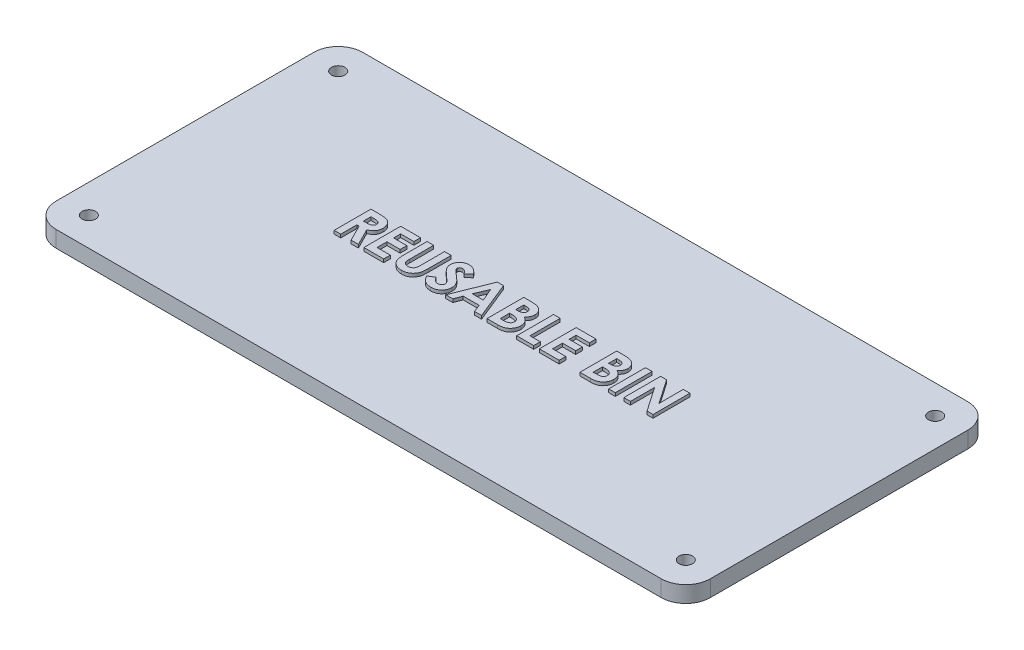
from build123d import *

# Parameters (mm, degrees)
LID_DEPTH          = 4
SKETCH2_R          = 1.65
SCREW_HOLES_DEPTH  = 110.731490467
SKETCH3_W          = 1.615384615
SKETCH3_H          = 9
TITLE_RAISED_DEPTH = 0.8


with BuildPart() as part:
    # Sketch1 → Lid (new body)
    with BuildSketch(Plane(origin=(0, 150, 0), x_dir=(1, 0, 0), z_dir=(0, 1, 0))):
        with BuildLine():
            Line((-74, -75), (74, -75))
            ThreePointArc((74, -75), (78.242640687, -73.242640687), (80, -69))
            Line((80, -69), (80, -6))
            ThreePointArc((80, -6), (78.242640687, -1.757359313), (74, 0))
            Line((74, 0), (-74, 0))
            ThreePointArc((-74, 0), (-78.242640687, -1.757359313), (-80, -6))
            Line((-80, -6), (-80, -69))
            ThreePointArc((-80, -69), (-78.242640687, -73.242640687), (-74, -75))
        make_face()
    extrude(amount=LID_DEPTH)

    # Sketch2 → Screw holes (cut, through all)
    with BuildSketch(Plane(origin=(0, 150, 0), x_dir=(1, 0, 0), z_dir=(0, 1, 0))):
        with Locations(Location((-73, -7, 0), (0, 0, 270))):
            Circle(SKETCH2_R)
        with Locations(Location((73, -7, 0), (0, 0, 270))):
            Circle(SKETCH2_R)
        with Locations(Location((-73, -68, 0), (0, 0, 270))):
            Circle(SKETCH2_R)
        with Locations(Location((73, -68, 0), (0, 0, 270))):
            Circle(SKETCH2_R)
    extrude(amount=SCREW_HOLES_DEPTH, mode=Mode.SUBTRACT)

    # Sketch3 → Title (raised) (add)
    # profile 1 of 11: a face of its own
    with BuildSketch(Plane(origin=(0, 154, 0), x_dir=(1, 0, 0), z_dir=(0, 1, 0))):
        with BuildLine():
            Line((-39, -33), (-37.117788462, -33))
            add(Edge.make_bspline(
                [(-37.117788462, -33), (-36.993374852, -33.000441597), (-36.754092435, -33.001290912), (-36.409060259, -33.014690857), (-36.092100756, -33.03333798), (-35.802744638, -33.061793985), (-35.541115697, -33.099523208), (-35.306951719, -33.143999719), (-35.100259549, -33.194690238), (-34.919296024, -33.257854624), (-34.755985391, -33.329103094), (-34.603757177, -33.410968893), (-34.459253, -33.502540419), (-34.323438716, -33.606227166), (-34.195134065, -33.720163836), (-34.074096994, -33.844465117), (-33.962037869, -33.980185032), (-33.859650564, -34.126466005), (-33.766332777, -34.280350234), (-33.683859426, -34.442049003), (-33.616791959, -34.611674763), (-33.557530663, -34.786776055), (-33.514846671, -34.969855986), (-33.485160579, -35.159132243), (-33.463425584, -35.355271097), (-33.462175926, -35.488519126), (-33.461538462, -35.556490385)],
                knots=[0, 0, 0, 0, 1.749336639, 3.364467119, 4.854658419, 6.213483162, 7.451590619, 8.570285859, 9.5643256, 10.440900261, 11.26203566, 12.067320669, 12.869050712, 13.665104639, 14.467235401, 15.27997916, 16.102287765, 16.939272006, 17.78853747, 18.631303466, 19.488103222, 20.351255419, 21.228522269, 22.127379805, 23.044756219, 24, 24, 24, 24], degree=3))
            add(Edge.make_bspline(
                [(-33.461538462, -35.556490385), (-33.463194364, -35.627436764), (-33.466441288, -35.766549683), (-33.483930984, -35.970895215), (-33.515896655, -36.166398727), (-33.564313313, -36.352487808), (-33.619961974, -36.531478554), (-33.693960417, -36.700068474), (-33.777474974, -36.860709464), (-33.876662774, -37.011129196), (-33.985516538, -37.154668794), (-34.112111177, -37.285828721), (-34.248245301, -37.411658329), (-34.401571505, -37.524276077), (-34.565331029, -37.631296771), (-34.742777602, -37.72828602), (-34.932753146, -37.817681911), (-35.066315361, -37.867535235), (-35.134615385, -37.893028846)],
                knots=[0, 0, 0, 0, 1.099860209, 2.156625411, 3.176576793, 4.16617041, 5.135385252, 6.078461593, 7.016046972, 7.938469504, 8.868247731, 9.803980173, 10.76021508, 11.73834243, 12.748633912, 13.790971185, 14.870363756, 16, 16, 16, 16], degree=3))
            Line((-35.134615385, -37.893028846), (-33.057692308, -42))
            Line((-33.057692308, -42), (-34.853365385, -42))
            Line((-34.853365385, -42), (-36.836538462, -38.076923077))
            Line((-36.836538462, -38.076923077), (-37.384615385, -38.076923077))
            Line((-37.384615385, -38.076923077), (-37.384615385, -42))
            Line((-37.384615385, -42), (-39, -42))
            Line((-39, -42), (-39, -33))
        make_face()
        with BuildLine():
            Line((-37.384615385, -36.461538462), (-36.755408654, -36.461538462))
            add(Edge.make_bspline(
                [(-36.755408654, -36.461538462), (-36.678482901, -36.460672072), (-36.531186613, -36.459013122), (-36.319355205, -36.451318225), (-36.126961767, -36.432777326), (-35.953180097, -36.409351594), (-35.797135742, -36.382303202), (-35.660220562, -36.343541215), (-35.540324904, -36.302006764), (-35.438869534, -36.250390216), (-35.352188397, -36.191691006), (-35.277344784, -36.125007243), (-35.215438385, -36.04782928), (-35.16448626, -35.962254479), (-35.124851047, -35.867525952), (-35.095920377, -35.764683605), (-35.079752412, -35.65255593), (-35.077892232, -35.575172566), (-35.076923077, -35.534855769)],
                knots=[0, 0, 0, 0, 1.688639943, 3.233382647, 4.650958383, 5.928841754, 7.082724185, 8.122798841, 9.049171256, 9.863274652, 10.613301712, 11.341792392, 12.054588806, 12.776240173, 13.521029143, 14.301969904, 15.115324896, 16, 16, 16, 16], degree=3))
            add(Edge.make_bspline(
                [(-35.076923077, -35.534855769), (-35.078755353, -35.487158055), (-35.082354521, -35.393464734), (-35.118069446, -35.258579205), (-35.174919892, -35.133733419), (-35.252846282, -35.01949146), (-35.350984439, -34.919339073), (-35.463605718, -34.831053946), (-35.593140756, -34.761244674), (-35.713080454, -34.715199221), (-35.822197544, -34.687649751), (-35.920672275, -34.66712013), (-36.034706607, -34.652570199), (-36.164386629, -34.637137406), (-36.309381782, -34.627130022), (-36.470482377, -34.619826625), (-36.647225734, -34.616838447), (-36.77043264, -34.615883179), (-36.834735577, -34.615384615)],
                knots=[0, 0, 0, 0, 1.020303359, 2.004196876, 2.966617323, 3.9489082, 4.950758222, 5.960522915, 7.003732012, 8.091992268, 8.70421221, 9.413913587, 10.24622431, 11.166358409, 12.212345909, 13.359657661, 14.621978493, 16, 16, 16, 16], degree=3))
            Line((-36.834735577, -34.615384615), (-37.384615385, -34.615384615))
            Line((-37.384615385, -34.615384615), (-37.384615385, -36.461538462))
        make_face(mode=Mode.SUBTRACT)
    # profile 2 of 11: a face of its own
    with BuildSketch(Plane(origin=(0, 154, 0), x_dir=(1, 0, 0), z_dir=(0, 1, 0))):
        Polygon((-31.730769231, -33), (-26.884615385, -33), (-26.884615385, -34.615384615), (-30.115384615, -34.615384615), (-30.115384615, -36.346153846), (-26.884615385, -36.346153846), (-26.884615385, -37.961538462), (-30.115384615, -37.961538462), (-30.115384615, -40.384615385), (-26.884615385, -40.384615385), (-26.884615385, -42), (-31.730769231, -42), align=None)
    # profile 3 of 11: a face of its own
    with BuildSketch(Plane(origin=(0, 154, 0), x_dir=(1, 0, 0), z_dir=(0, 1, 0))):
        with BuildLine():
            Line((-25.269230769, -33), (-23.653846154, -33))
            Line((-23.653846154, -33), (-23.653846154, -38.855769231))
            add(Edge.make_bspline(
                [(-23.653846154, -38.855769231), (-23.653758317, -38.916479306), (-23.653588662, -39.03374019), (-23.645095615, -39.201971166), (-23.637323892, -39.356610658), (-23.623301497, -39.497489366), (-23.602585613, -39.624667556), (-23.582525878, -39.738962173), (-23.555377011, -39.838326902), (-23.514576603, -39.951429978), (-23.451716569, -40.078507462), (-23.34900676, -40.210950531), (-23.230488428, -40.331824054), (-23.08843738, -40.432434596), (-22.928784565, -40.513819455), (-22.752407204, -40.57411663), (-22.559553926, -40.607633852), (-22.426206464, -40.61275087), (-22.357572115, -40.615384615)],
                knots=[0, 0, 0, 0, 1.155499968, 2.231836252, 3.205919964, 4.102923608, 4.924856345, 5.658536265, 6.31071849, 6.882491295, 7.94666036, 8.992281882, 10.060072772, 11.158554251, 12.289267114, 13.461410017, 14.693379945, 16, 16, 16, 16], degree=3))
            add(Edge.make_bspline(
                [(-22.357572115, -40.615384615), (-22.28465659, -40.613256888), (-22.142483661, -40.609108179), (-21.937990536, -40.56838411), (-21.748526495, -40.503537445), (-21.57810314, -40.410984727), (-21.426890068, -40.300044075), (-21.298891371, -40.173536966), (-21.19787527, -40.031211082), (-21.132036733, -39.899904616), (-21.095071637, -39.779048448), (-21.067364457, -39.671068048), (-21.047052028, -39.543661865), (-21.028623925, -39.39881962), (-21.017550055, -39.235041028), (-21.005542248, -39.053643216), (-21.001141275, -38.853385013), (-21.000391161, -38.713941467), (-21, -38.641225962)],
                knots=[0, 0, 0, 0, 1.261321664, 2.459363699, 3.594844139, 4.716940403, 5.803436589, 6.833651888, 7.818396249, 8.814403945, 9.360733334, 10.004355033, 10.743453831, 11.592799886, 12.532235708, 13.585170094, 14.740740724, 16, 16, 16, 16], degree=3))
            Line((-21, -38.641225962), (-21, -33))
            Line((-21, -33), (-19.384615385, -33))
            Line((-19.384615385, -33), (-19.384615385, -38.368990385))
            add(Edge.make_bspline(
                [(-19.384615385, -38.368990385), (-19.38483971, -38.477765873), (-19.385271066, -38.686930529), (-19.391895395, -38.987514859), (-19.405997394, -39.262050429), (-19.417841446, -39.510617457), (-19.440763742, -39.732881082), (-19.464643398, -39.929790434), (-19.495080074, -40.100647709), (-19.540368017, -40.295147954), (-19.6185216, -40.519107863), (-19.744515421, -40.776987989), (-19.904456423, -41.029468254), (-20.093498693, -41.273771199), (-20.306944709, -41.500720762), (-20.540061915, -41.699953102), (-20.789146658, -41.868482178), (-21.056801695, -42.002187251), (-21.342799239, -42.106467128), (-21.64996902, -42.176537953), (-21.978101575, -42.223878682), (-22.204748932, -42.228426341), (-22.321514423, -42.230769231)],
                knots=[0, 0, 0, 0, 1.170808336, 2.251350247, 3.235597562, 4.129743112, 4.929140599, 5.639994148, 6.264258765, 6.79612947, 7.788252245, 8.809469599, 9.879094798, 10.999557536, 12.129761673, 13.226370002, 14.293821979, 15.358369427, 16.438775801, 17.562147481, 18.744053101, 20, 20, 20, 20], degree=3))
            add(Edge.make_bspline(
                [(-22.321514423, -42.230769231), (-22.399095738, -42.229462476), (-22.552162081, -42.226884276), (-22.777272991, -42.204151283), (-22.994886906, -42.170651399), (-23.20459493, -42.121778519), (-23.407124922, -42.058643885), (-23.602423074, -41.980929549), (-23.78976361, -41.889068989), (-23.968098199, -41.783907126), (-24.137207386, -41.670192673), (-24.291764454, -41.544135416), (-24.437088074, -41.415057764), (-24.568979907, -41.277527581), (-24.688430578, -41.132988701), (-24.79519408, -40.98111355), (-24.889111796, -40.821915619), (-24.972546175, -40.652525375), (-25.043957861, -40.464333323), (-25.104160595, -40.250645393), (-25.156755119, -40.008112242), (-25.195840267, -39.736187454), (-25.231275091, -39.435767264), (-25.253703381, -39.106069031), (-25.265436629, -38.747083296), (-25.267934099, -38.498205928), (-25.269230769, -38.368990385)],
                knots=[0, 0, 0, 0, 1.001158378, 1.975264943, 2.917723546, 3.841610987, 4.75185031, 5.653588123, 6.552117133, 7.442167995, 8.324307438, 9.179605724, 10.014504199, 10.831958861, 11.636465792, 12.43274043, 13.225645099, 14.020104002, 14.867201867, 15.819789774, 16.883317127, 18.068162734, 19.364263498, 20.787406516, 22.332041935, 24, 24, 24, 24], degree=3))
            Line((-25.269230769, -38.368990385), (-25.269230769, -33))
        make_face()
    # profile 4 of 11: a face of its own
    with BuildSketch(Plane(origin=(0, 154, 0), x_dir=(1, 0, 0), z_dir=(0, 1, 0))):
        with BuildLine():
            Line((-12.692307692, -34.202524038), (-13.900240385, -35.307692308))
            add(Edge.make_bspline(
                [(-13.900240385, -35.307692308), (-13.951983042, -35.234703911), (-14.051321727, -35.094576367), (-14.212339376, -34.906942283), (-14.372629947, -34.746876447), (-14.533678435, -34.615047537), (-14.696912314, -34.512256515), (-14.862048232, -34.439479336), (-15.028149988, -34.393214192), (-15.139744728, -34.387453068), (-15.194711538, -34.384615385)],
                knots=[0, 0, 0, 0, 1.299362458, 2.494594718, 3.587462134, 4.587049575, 5.512617175, 6.380583204, 7.202344345, 8, 8, 8, 8], degree=3))
            add(Edge.make_bspline(
                [(-15.194711538, -34.384615385), (-15.245983002, -34.386413471), (-15.344974728, -34.389885104), (-15.486094778, -34.424392876), (-15.611383167, -34.483948222), (-15.720717621, -34.561821847), (-15.80732664, -34.655641511), (-15.876477224, -34.754034216), (-15.915414814, -34.86263751), (-15.920539767, -34.937230633), (-15.923076923, -34.974158654)],
                knots=[0, 0, 0, 0, 1.185010067, 2.2879431, 3.333075148, 4.379039566, 5.372662701, 6.27520591, 7.14612461, 8, 8, 8, 8], degree=3))
            add(Edge.make_bspline(
                [(-15.923076923, -34.974158654), (-15.921487016, -35.011619193), (-15.918285165, -35.087059514), (-15.887359638, -35.197626699), (-15.840746038, -35.30566371), (-15.79620484, -35.371430979), (-15.7734375, -35.405048077)],
                knots=[0, 0, 0, 0, 0.967525499, 1.948461899, 2.951351359, 4, 4, 4, 4], degree=3))
            add(Edge.make_bspline(
                [(-15.7734375, -35.405048077), (-15.752739525, -35.431178296), (-15.705095519, -35.491326608), (-15.614248158, -35.586592158), (-15.500162953, -35.703300797), (-15.358449664, -35.837439255), (-15.194991199, -35.993831676), (-15.002211049, -36.166330214), (-14.785658265, -36.360276949), (-14.631737563, -36.495334433), (-14.551081731, -36.566105769)],
                knots=[0, 0, 0, 0, 0.473873513, 1.090794244, 1.870441696, 2.795289791, 3.865433203, 5.087734844, 6.473946851, 8, 8, 8, 8], degree=3))
            add(Edge.make_bspline(
                [(-14.551081731, -36.566105769), (-14.47537463, -36.631626447), (-14.33169828, -36.75597108), (-14.127275367, -36.932458322), (-13.947621672, -37.091239591), (-13.790120051, -37.229931918), (-13.657158076, -37.349990505), (-13.548176774, -37.45198923), (-13.461845123, -37.533942365), (-13.412770634, -37.583442109), (-13.391826923, -37.604567308)],
                knots=[0, 0, 0, 0, 1.543621617, 2.929473131, 4.163658386, 5.240097082, 6.164993805, 6.925417477, 7.541396219, 8, 8, 8, 8], degree=3))
            add(Edge.make_bspline(
                [(-13.391826923, -37.604567308), (-13.312370849, -37.690555797), (-13.15962837, -37.855855872), (-12.961116993, -38.112019001), (-12.797735709, -38.362086449), (-12.671340849, -38.610763638), (-12.575882367, -38.861638487), (-12.508582873, -39.120863687), (-12.468276758, -39.391147979), (-12.463801838, -39.575584013), (-12.461538462, -39.668870192)],
                knots=[0, 0, 0, 0, 1.206664779, 2.319633467, 3.337109185, 4.282041471, 5.190008762, 6.099243693, 7.03861361, 8, 8, 8, 8], degree=3))
            add(Edge.make_bspline(
                [(-12.461538462, -39.668870192), (-12.463149475, -39.759766133), (-12.466310343, -39.938107352), (-12.505024917, -40.199083161), (-12.560229627, -40.448848337), (-12.645585794, -40.684685081), (-12.749617384, -40.910464582), (-12.880036008, -41.122669913), (-13.033194798, -41.323448678), (-13.208738288, -41.509211713), (-13.402910233, -41.677778791), (-13.611178098, -41.827841185), (-13.835578431, -41.951736806), (-14.07419399, -42.053756013), (-14.32689705, -42.13233257), (-14.593386566, -42.190407969), (-14.874070152, -42.225263908), (-15.066005633, -42.228907683), (-15.1640625, -42.230769231)],
                knots=[0, 0, 0, 0, 1.043214005, 2.046824704, 3.02475056, 3.976699089, 4.921714032, 5.875962561, 6.831408892, 7.817874052, 8.806269674, 9.781291748, 10.760897367, 11.74438705, 12.757449933, 13.795994037, 14.874007457, 16, 16, 16, 16], degree=3))
            add(Edge.make_bspline(
                [(-15.1640625, -42.230769231), (-15.241036306, -42.229403664), (-15.393488585, -42.226699059), (-15.618180198, -42.20461821), (-15.83514535, -42.16898207), (-16.044139649, -42.117904835), (-16.246104652, -42.053183052), (-16.441048653, -41.974127872), (-16.627625889, -41.879513971), (-16.807248092, -41.771286986), (-16.979042076, -41.645621201), (-17.145180108, -41.505085811), (-17.304011949, -41.34751932), (-17.456300435, -41.173294365), (-17.601071181, -40.981917583), (-17.743063054, -40.776054251), (-17.875965508, -40.551883825), (-17.958065266, -40.394626457), (-18, -40.314302885)],
                knots=[0, 0, 0, 0, 1.016823716, 2.013894106, 2.979844003, 3.91962641, 4.853723003, 5.779685073, 6.695824784, 7.614987388, 8.547259901, 9.504950863, 10.487499108, 11.500346958, 12.559593716, 13.656357062, 14.802919212, 16, 16, 16, 16], degree=3))
            Line((-18, -40.314302885), (-16.579326923, -39.461538462))
            add(Edge.make_bspline(
                [(-16.579326923, -39.461538462), (-16.526872839, -39.552716211), (-16.426313876, -39.72751175), (-16.255907312, -39.962371711), (-16.081334487, -40.16349039), (-15.898559433, -40.327313003), (-15.709804627, -40.456030069), (-15.514158339, -40.548020214), (-15.311483112, -40.60496201), (-15.173429955, -40.611915919), (-15.104567308, -40.615384615)],
                knots=[0, 0, 0, 0, 1.283663364, 2.460892379, 3.537111102, 4.529833553, 5.449777664, 6.316464042, 7.160231139, 8, 8, 8, 8], degree=3))
            add(Edge.make_bspline(
                [(-15.104567308, -40.615384615), (-15.034524137, -40.61255189), (-14.898630184, -40.607055989), (-14.704658956, -40.55629201), (-14.526818789, -40.47658884), (-14.373095063, -40.362863407), (-14.242931503, -40.231606973), (-14.146863325, -40.085578188), (-14.086512648, -39.927578568), (-14.080132118, -39.817821639), (-14.076923077, -39.762620192)],
                knots=[0, 0, 0, 0, 1.13588714, 2.203786484, 3.234766741, 4.283437687, 5.291419208, 6.222934724, 7.106237994, 8, 8, 8, 8], degree=3))
            add(Edge.make_bspline(
                [(-14.076923077, -39.762620192), (-14.079886495, -39.71126423), (-14.085906395, -39.606939508), (-14.130247121, -39.451825422), (-14.199565201, -39.296781879), (-14.281573378, -39.16961097), (-14.365026966, -39.063134215), (-14.44482742, -38.970876924), (-14.542003263, -38.868948769), (-14.6563081, -38.757221531), (-14.786231666, -38.634711648), (-14.931883404, -38.501431116), (-15.094931182, -38.358553977), (-15.210173673, -38.261227482), (-15.270432692, -38.210336538)],
                knots=[0, 0, 0, 0, 0.916159276, 1.861089862, 2.860218735, 3.940849679, 4.552606315, 5.27541173, 6.11797699, 7.06649574, 8.129236253, 9.306560635, 10.591630461, 12, 12, 12, 12], degree=3))
            add(Edge.make_bspline(
                [(-15.270432692, -38.210336538), (-15.384987486, -38.113412198), (-15.604852808, -37.927385052), (-15.915550403, -37.652628814), (-16.195516755, -37.395843934), (-16.442333775, -37.153855989), (-16.659146293, -36.931133936), (-16.844485961, -36.725868742), (-16.996316738, -36.536477065), (-17.156085891, -36.312155298), (-17.307898531, -36.038803812), (-17.439107733, -35.709930285), (-17.524230725, -35.381098487), (-17.533767572, -35.16033893), (-17.538461538, -35.051682692)],
                knots=[0, 0, 0, 0, 1.345494975, 2.582412109, 3.71882943, 4.751509156, 5.681369928, 6.505683931, 7.230279997, 7.856715994, 8.973648664, 10.023341002, 11.027102913, 12, 12, 12, 12], degree=3))
            add(Edge.make_bspline(
                [(-17.538461538, -35.051682692), (-17.536509324, -34.97462952), (-17.532663252, -34.822826495), (-17.498355696, -34.599622264), (-17.447081747, -34.384248936), (-17.372617252, -34.17749229), (-17.275971328, -33.979611298), (-17.158598609, -33.789637249), (-17.018676517, -33.60931862), (-16.860993765, -33.438774951), (-16.687267744, -33.282917446), (-16.501619413, -33.14535758), (-16.305099558, -33.029172517), (-16.098910388, -32.932788571), (-15.881774235, -32.859012783), (-15.655290731, -32.806716827), (-15.419135026, -32.77561286), (-15.258507013, -32.771384637), (-15.176682692, -32.769230769)],
                knots=[0, 0, 0, 0, 1.010766082, 1.991317756, 2.957454644, 3.913069143, 4.869106762, 5.843196583, 6.838735724, 7.860187025, 8.887984031, 9.89767229, 10.887916223, 11.879572884, 12.879850636, 13.892031539, 14.926195476, 16, 16, 16, 16], degree=3))
            add(Edge.make_bspline(
                [(-15.176682692, -32.769230769), (-15.070642423, -32.773109948), (-14.859398928, -32.780837685), (-14.547069329, -32.841266064), (-14.241998835, -32.936296055), (-13.996167314, -33.050939284), (-13.800563761, -33.161994234), (-13.650651909, -33.264239643), (-13.498108531, -33.381367254), (-13.341703459, -33.513746167), (-13.184342941, -33.663870576), (-13.021552464, -33.828166649), (-12.855550249, -34.00805429), (-12.74767513, -34.136565186), (-12.692307692, -34.202524038)],
                knots=[0, 0, 0, 0, 1.282922637, 2.555718331, 3.837320111, 5.142675274, 5.830281639, 6.55870424, 7.337177975, 8.157850921, 9.037902056, 9.96903443, 10.957596896, 12, 12, 12, 12], degree=3))
        make_face()
    # profile 5 of 11: a face of its own
    with BuildSketch(Plane(origin=(0, 154, 0), x_dir=(1, 0, 0), z_dir=(0, 1, 0))):
        Polygon((-8.078725962, -33), (-6.576923077, -33), (-2.942307692, -42), (-4.667668269, -42), (-5.3671875, -40.153846154), (-9.284855769, -40.153846154), (-9.986177885, -42), (-11.711538462, -42), align=None)
        Polygon((-7.326923077, -35.4140625), (-8.671875, -38.538461538), (-5.980168269, -38.538461538), align=None, mode=Mode.SUBTRACT)
    # profile 6 of 11: a face of its own
    with BuildSketch(Plane(origin=(0, 154, 0), x_dir=(1, 0, 0), z_dir=(0, 1, 0))):
        with BuildLine():
            Line((-1.615384615, -42), (-1.615384615, -33))
            Line((-1.615384615, -33), (-0.173076923, -33))
            add(Edge.make_bspline(
                [(-0.173076923, -33), (-0.072106366, -32.999988477), (0.123269747, -32.99996618), (0.40514649, -33.009864765), (0.666563363, -33.022669695), (0.906688438, -33.036995433), (1.125930424, -33.061681543), (1.323955927, -33.087698006), (1.501160603, -33.119072257), (1.610716626, -33.147215933), (1.662259615, -33.160456731)],
                knots=[0, 0, 0, 0, 1.311965854, 2.538629056, 3.664479157, 4.713267157, 5.663616078, 6.530575999, 7.308677837, 8, 8, 8, 8], degree=3))
            add(Edge.make_bspline(
                [(1.662259615, -33.160456731), (1.729940794, -33.179133112), (1.862752994, -33.215782168), (2.052982449, -33.289796521), (2.233441622, -33.372068722), (2.403910177, -33.465925915), (2.563341371, -33.572501221), (2.71112931, -33.692640453), (2.850461415, -33.821521227), (2.97639032, -33.962735415), (3.090209302, -34.111954362), (3.18909759, -34.26913897), (3.275018838, -34.431885783), (3.343778342, -34.602242862), (3.395587337, -34.779425666), (3.433480219, -34.962677597), (3.458039938, -35.15257851), (3.460360509, -35.281774308), (3.461538462, -35.347355769)],
                knots=[0, 0, 0, 0, 1.099996261, 2.158545794, 3.195537121, 4.207578794, 5.205712374, 6.197378256, 7.190519799, 8.17788031, 9.159561366, 10.129234751, 11.085776129, 12.040971148, 13.00380137, 13.975669004, 14.972423361, 16, 16, 16, 16], degree=3))
            add(Edge.make_bspline(
                [(3.461538462, -35.347355769), (3.458458467, -35.431610732), (3.452395876, -35.597456275), (3.413667631, -35.841053372), (3.341046137, -36.071287642), (3.246022679, -36.292402215), (3.116820485, -36.503572333), (2.952758685, -36.704697589), (2.756494545, -36.901970933), (2.605949116, -37.020222996), (2.527644231, -37.081730769)],
                knots=[0, 0, 0, 0, 0.986156485, 1.941127874, 2.875419072, 3.804401753, 4.751181392, 5.761612777, 6.835722519, 8, 8, 8, 8], degree=3))
            add(Edge.make_bspline(
                [(2.527644231, -37.081730769), (2.591098753, -37.114123752), (2.715515515, -37.177637431), (2.892150766, -37.282034957), (3.055695727, -37.393074968), (3.206883684, -37.508523292), (3.342543297, -37.633273951), (3.468276178, -37.760138641), (3.577879321, -37.896386182), (3.675889755, -38.037160451), (3.761078831, -38.184499876), (3.835269123, -38.338155635), (3.897935001, -38.498652648), (3.951002087, -38.665174116), (3.990579534, -38.838292794), (4.016384871, -39.018070598), (4.03614305, -39.203894393), (4.037680051, -39.330472922), (4.038461538, -39.394831731)],
                knots=[0, 0, 0, 0, 1.164658916, 2.283573913, 3.35186032, 4.395461096, 5.390182219, 6.362969632, 7.312859996, 8.245001507, 9.165155236, 10.092416118, 11.032087915, 11.979892451, 12.947605196, 13.931445124, 14.948243989, 16, 16, 16, 16], degree=3))
            add(Edge.make_bspline(
                [(4.038461538, -39.394831731), (4.033390207, -39.517753376), (4.023381956, -39.760338751), (3.950206502, -40.116509795), (3.823343517, -40.454192249), (3.652992688, -40.772044019), (3.443087691, -41.060863818), (3.201757139, -41.313867454), (2.931430676, -41.528029415), (2.682021841, -41.672572125), (2.466302839, -41.7695738), (2.287626821, -41.829546352), (2.095732564, -41.885104834), (1.887105028, -41.924119147), (1.665526344, -41.959829337), (1.428836107, -41.981877548), (1.177476687, -41.996819077), (1.004832171, -41.998918256), (0.915865385, -42)],
                knots=[0, 0, 0, 0, 1.284142165, 2.534249414, 3.780121997, 5.041676246, 6.291546858, 7.49970053, 8.684500223, 9.883330709, 10.50184324, 11.153274765, 11.851151195, 12.587658647, 13.369265475, 14.195992086, 15.070362669, 16, 16, 16, 16], degree=3))
            Line((0.915865385, -42), (-1.615384615, -42))
        make_face()
        with BuildLine():
            Line((0, -34.615384615), (0, -36.576923077))
            Line((0, -36.576923077), (0.429086538, -36.576923077))
            add(Edge.make_bspline(
                [(0.429086538, -36.576923077), (0.487403254, -36.576414533), (0.599980145, -36.57543282), (0.762585522, -36.562788696), (0.913782262, -36.541217036), (1.05299691, -36.511119144), (1.1815263, -36.472899208), (1.29854935, -36.426912395), (1.40355153, -36.370803485), (1.525539777, -36.287226787), (1.654490151, -36.164239933), (1.768003715, -35.986559942), (1.834862447, -35.782228628), (1.842308706, -35.638118364), (1.846153846, -35.563701923)],
                knots=[0, 0, 0, 0, 1.065314748, 2.056525647, 2.977365736, 3.853934255, 4.656397591, 5.425096493, 6.14721249, 6.826394842, 8.123232004, 9.372140726, 10.643011755, 12, 12, 12, 12], degree=3))
            add(Edge.make_bspline(
                [(1.846153846, -35.563701923), (1.84307703, -35.493998562), (1.837128131, -35.359229914), (1.769809984, -35.170002731), (1.665251594, -35.002308718), (1.541805719, -34.887535881), (1.42555744, -34.809149417), (1.32601853, -34.757535268), (1.216767102, -34.71133081), (1.095688164, -34.676001755), (0.963473146, -34.649492076), (0.820764287, -34.630023891), (0.667315368, -34.616773017), (0.561327872, -34.615857343), (0.506610577, -34.615384615)],
                knots=[0, 0, 0, 0, 1.347982417, 2.606269829, 3.849316587, 5.153353503, 5.842674298, 6.568177932, 7.326619318, 8.142485038, 9.012069166, 9.942760135, 10.937925643, 12, 12, 12, 12], degree=3))
            Line((0.506610577, -34.615384615), (0, -34.615384615))
        make_face(mode=Mode.SUBTRACT)
        with BuildLine():
            Line((0, -38.076923077), (0, -40.384615385))
            Line((0, -40.384615385), (0.465144231, -40.384615385))
            add(Edge.make_bspline(
                [(0.465144231, -40.384615385), (0.557103837, -40.384090023), (0.733907656, -40.383079949), (0.987178814, -40.370875857), (1.217465614, -40.348880133), (1.424157883, -40.321420242), (1.60757221, -40.284216385), (1.76708861, -40.236916449), (1.904894644, -40.184878281), (2.020164021, -40.120604965), (2.114332498, -40.045806763), (2.199309675, -39.969361204), (2.268594771, -39.88117403), (2.323414431, -39.785030871), (2.370860751, -39.683319993), (2.39947702, -39.572069623), (2.421264443, -39.454576954), (2.422463463, -39.373309817), (2.423076923, -39.331730769)],
                knots=[0, 0, 0, 0, 1.753078804, 3.370512758, 4.83203934, 6.162291463, 7.344201807, 8.395507345, 9.331626367, 10.147333109, 10.898971645, 11.62040215, 12.321813352, 13.025280112, 13.727906689, 14.453419512, 15.208716525, 16, 16, 16, 16], degree=3))
            add(Edge.make_bspline(
                [(2.423076923, -39.331730769), (2.421724068, -39.284184475), (2.419089071, -39.191577083), (2.397569017, -39.056221498), (2.358460048, -38.929858078), (2.309200394, -38.80925554), (2.240652968, -38.698731876), (2.159186695, -38.594462281), (2.06075464, -38.499977644), (1.950062052, -38.409563182), (1.820950107, -38.330400422), (1.67335823, -38.261712706), (1.506484621, -38.204347255), (1.319812372, -38.158672845), (1.114159839, -38.119909605), (0.888025985, -38.096763672), (0.64329413, -38.079549024), (0.47359308, -38.077818282), (0.385817308, -38.076923077)],
                knots=[0, 0, 0, 0, 0.845221588, 1.646264278, 2.427170338, 3.19324141, 3.95557735, 4.731569926, 5.540061037, 6.376114724, 7.268642756, 8.224665384, 9.265483498, 10.400594375, 11.639216012, 12.983232105, 14.439614077, 16, 16, 16, 16], degree=3))
            Line((0.385817308, -38.076923077), (0, -38.076923077))
        make_face(mode=Mode.SUBTRACT)
    # profile 7 of 11: a face of its own
    with BuildSketch(Plane(origin=(0, 154, 0), x_dir=(1, 0, 0), z_dir=(0, 1, 0))):
        Polygon((5.653846154, -33), (7.269230769, -33), (7.269230769, -40.384615385), (9.807692308, -40.384615385), (9.807692308, -42), (5.653846154, -42), align=None)
    # profile 8 of 11: a face of its own
    with BuildSketch(Plane(origin=(0, 154, 0), x_dir=(1, 0, 0), z_dir=(0, 1, 0))):
        Polygon((11.192307692, -33), (16.038461538, -33), (16.038461538, -34.615384615), (12.807692308, -34.615384615), (12.807692308, -36.346153846), (16.038461538, -36.346153846), (16.038461538, -37.961538462), (12.807692308, -37.961538462), (12.807692308, -40.384615385), (16.038461538, -40.384615385), (16.038461538, -42), (11.192307692, -42), align=None)
    # profile 9 of 11: a face of its own
    with BuildSketch(Plane(origin=(0, 154, 0), x_dir=(1, 0, 0), z_dir=(0, 1, 0))):
        with BuildLine():
            Line((21.115384615, -42), (21.115384615, -33))
            Line((21.115384615, -33), (22.557692308, -33))
            add(Edge.make_bspline(
                [(22.557692308, -33), (22.658662865, -32.999988477), (22.854038978, -32.99996618), (23.13591572, -33.009864765), (23.397332594, -33.022669695), (23.637457669, -33.036995433), (23.856699655, -33.061681543), (24.054725158, -33.087698006), (24.231929834, -33.119072257), (24.341485856, -33.147215933), (24.393028846, -33.160456731)],
                knots=[0, 0, 0, 0, 1.311965854, 2.538629056, 3.664479157, 4.713267157, 5.663616078, 6.530575999, 7.308677837, 8, 8, 8, 8], degree=3))
            add(Edge.make_bspline(
                [(24.393028846, -33.160456731), (24.460710025, -33.179133112), (24.593522225, -33.215782168), (24.783751679, -33.289796521), (24.964210852, -33.372068722), (25.134679408, -33.465925915), (25.294110602, -33.572501221), (25.441898541, -33.692640453), (25.581230646, -33.821521227), (25.707159551, -33.962735415), (25.820978532, -34.111954362), (25.919866821, -34.26913897), (26.005788069, -34.431885783), (26.074547573, -34.602242862), (26.126356568, -34.779425666), (26.16424945, -34.962677597), (26.188809169, -35.15257851), (26.19112974, -35.281774308), (26.192307692, -35.347355769)],
                knots=[0, 0, 0, 0, 1.099996261, 2.158545794, 3.195537121, 4.207578794, 5.205712374, 6.197378256, 7.190519799, 8.17788031, 9.159561366, 10.129234751, 11.085776129, 12.040971148, 13.00380137, 13.975669004, 14.972423361, 16, 16, 16, 16], degree=3))
            add(Edge.make_bspline(
                [(26.192307692, -35.347355769), (26.189227698, -35.431610732), (26.183165106, -35.597456275), (26.144436861, -35.841053372), (26.071815368, -36.071287642), (25.97679191, -36.292402215), (25.847589715, -36.503572333), (25.683527916, -36.704697589), (25.487263776, -36.901970933), (25.336718346, -37.020222996), (25.258413462, -37.081730769)],
                knots=[0, 0, 0, 0, 0.986156485, 1.941127874, 2.875419072, 3.804401753, 4.751181392, 5.761612777, 6.835722519, 8, 8, 8, 8], degree=3))
            add(Edge.make_bspline(
                [(25.258413462, -37.081730769), (25.321867984, -37.114123752), (25.446284746, -37.177637431), (25.622919996, -37.282034957), (25.786464957, -37.393074968), (25.937652914, -37.508523292), (26.073312527, -37.633273951), (26.199045409, -37.760138641), (26.308648552, -37.896386182), (26.406658986, -38.037160451), (26.491848062, -38.184499876), (26.566038354, -38.338155635), (26.628704232, -38.498652648), (26.681771318, -38.665174116), (26.721348765, -38.838292794), (26.747154102, -39.018070598), (26.766912281, -39.203894393), (26.768449282, -39.330472922), (26.769230769, -39.394831731)],
                knots=[0, 0, 0, 0, 1.164658916, 2.283573913, 3.35186032, 4.395461096, 5.390182219, 6.362969632, 7.312859996, 8.245001507, 9.165155236, 10.092416118, 11.032087915, 11.979892451, 12.947605196, 13.931445124, 14.948243989, 16, 16, 16, 16], degree=3))
            add(Edge.make_bspline(
                [(26.769230769, -39.394831731), (26.764159438, -39.517753376), (26.754151186, -39.760338751), (26.680975733, -40.116509795), (26.554112748, -40.454192249), (26.383761919, -40.772044019), (26.173856922, -41.060863818), (25.93252637, -41.313867454), (25.662199907, -41.528029415), (25.412791071, -41.672572125), (25.19707207, -41.7695738), (25.018396052, -41.829546352), (24.826501795, -41.885104834), (24.617874259, -41.924119147), (24.396295575, -41.959829337), (24.159605338, -41.981877548), (23.908245917, -41.996819077), (23.735601402, -41.998918256), (23.646634615, -42)],
                knots=[0, 0, 0, 0, 1.284142165, 2.534249414, 3.780121997, 5.041676246, 6.291546858, 7.49970053, 8.684500223, 9.883330709, 10.50184324, 11.153274765, 11.851151195, 12.587658647, 13.369265475, 14.195992086, 15.070362669, 16, 16, 16, 16], degree=3))
            Line((23.646634615, -42), (21.115384615, -42))
        make_face()
        with BuildLine():
            Line((22.730769231, -34.615384615), (22.730769231, -36.576923077))
            Line((22.730769231, -36.576923077), (23.159855769, -36.576923077))
            add(Edge.make_bspline(
                [(23.159855769, -36.576923077), (23.218172485, -36.576414533), (23.330749375, -36.57543282), (23.493354752, -36.562788696), (23.644551493, -36.541217036), (23.783766141, -36.511119144), (23.912295531, -36.472899208), (24.029318581, -36.426912395), (24.134320761, -36.370803485), (24.256309008, -36.287226787), (24.385259382, -36.164239933), (24.498772946, -35.986559942), (24.565631678, -35.782228628), (24.573077937, -35.638118364), (24.576923077, -35.563701923)],
                knots=[0, 0, 0, 0, 1.065314748, 2.056525647, 2.977365736, 3.853934255, 4.656397591, 5.425096493, 6.14721249, 6.826394842, 8.123232004, 9.372140726, 10.643011755, 12, 12, 12, 12], degree=3))
            add(Edge.make_bspline(
                [(24.576923077, -35.563701923), (24.573846261, -35.493998562), (24.567897361, -35.359229914), (24.500579215, -35.170002731), (24.396020825, -35.002308718), (24.27257495, -34.887535881), (24.156326671, -34.809149417), (24.056787761, -34.757535268), (23.947536332, -34.71133081), (23.826457395, -34.676001755), (23.694242376, -34.649492076), (23.551533518, -34.630023891), (23.398084598, -34.616773017), (23.292097103, -34.615857343), (23.237379808, -34.615384615)],
                knots=[0, 0, 0, 0, 1.347982417, 2.606269829, 3.849316587, 5.153353503, 5.842674298, 6.568177932, 7.326619318, 8.142485038, 9.012069166, 9.942760135, 10.937925643, 12, 12, 12, 12], degree=3))
            Line((23.237379808, -34.615384615), (22.730769231, -34.615384615))
        make_face(mode=Mode.SUBTRACT)
        with BuildLine():
            Line((22.730769231, -38.076923077), (22.730769231, -40.384615385))
            Line((22.730769231, -40.384615385), (23.195913462, -40.384615385))
            add(Edge.make_bspline(
                [(23.195913462, -40.384615385), (23.287873068, -40.384090023), (23.464676887, -40.383079949), (23.717948044, -40.370875857), (23.948234844, -40.348880133), (24.154927114, -40.321420242), (24.33834144, -40.284216385), (24.497857841, -40.236916449), (24.635663875, -40.184878281), (24.750933252, -40.120604965), (24.845101729, -40.045806763), (24.930078906, -39.969361204), (24.999364002, -39.88117403), (25.054183662, -39.785030871), (25.101629981, -39.683319993), (25.130246251, -39.572069623), (25.152033674, -39.454576954), (25.153232694, -39.373309817), (25.153846154, -39.331730769)],
                knots=[0, 0, 0, 0, 1.753078804, 3.370512758, 4.83203934, 6.162291463, 7.344201807, 8.395507345, 9.331626367, 10.147333109, 10.898971645, 11.62040215, 12.321813352, 13.025280112, 13.727906689, 14.453419512, 15.208716525, 16, 16, 16, 16], degree=3))
            add(Edge.make_bspline(
                [(25.153846154, -39.331730769), (25.152493299, -39.284184475), (25.149858302, -39.191577083), (25.128338247, -39.056221498), (25.089229279, -38.929858078), (25.039969625, -38.80925554), (24.971422199, -38.698731876), (24.889955926, -38.594462281), (24.791523871, -38.499977644), (24.680831283, -38.409563182), (24.551719338, -38.330400422), (24.404127461, -38.261712706), (24.237253852, -38.204347255), (24.050581603, -38.158672845), (23.84492907, -38.119909605), (23.618795215, -38.096763672), (23.374063361, -38.079549024), (23.20436231, -38.077818282), (23.116586538, -38.076923077)],
                knots=[0, 0, 0, 0, 0.845221588, 1.646264278, 2.427170338, 3.19324141, 3.95557735, 4.731569926, 5.540061037, 6.376114724, 7.268642756, 8.224665384, 9.265483498, 10.400594375, 11.639216012, 12.983232105, 14.439614077, 16, 16, 16, 16], degree=3))
            Line((23.116586538, -38.076923077), (22.730769231, -38.076923077))
        make_face(mode=Mode.SUBTRACT)
    # profile 10 of 11: a face of its own
    with BuildSketch(Plane(origin=(0, 154, 0), x_dir=(1, 0, 0), z_dir=(0, 1, 0))):
        with Locations((28.961538462, -37.5)):
            Rectangle(SKETCH3_W, SKETCH3_H)
    # profile 11 of 11: a face of its own
    with BuildSketch(Plane(origin=(0, 154, 0), x_dir=(1, 0, 0), z_dir=(0, 1, 0))):
        Polygon((31.846153846, -33), (33.301081731, -33), (37.384615385, -38.922475962), (37.384615385, -33), (39, -33), (39, -42), (37.534254808, -42), (33.461538462, -36.095552885), (33.461538462, -42), (31.846153846, -42), align=None)
    extrude(amount=TITLE_RAISED_DEPTH)


solid = part.part
